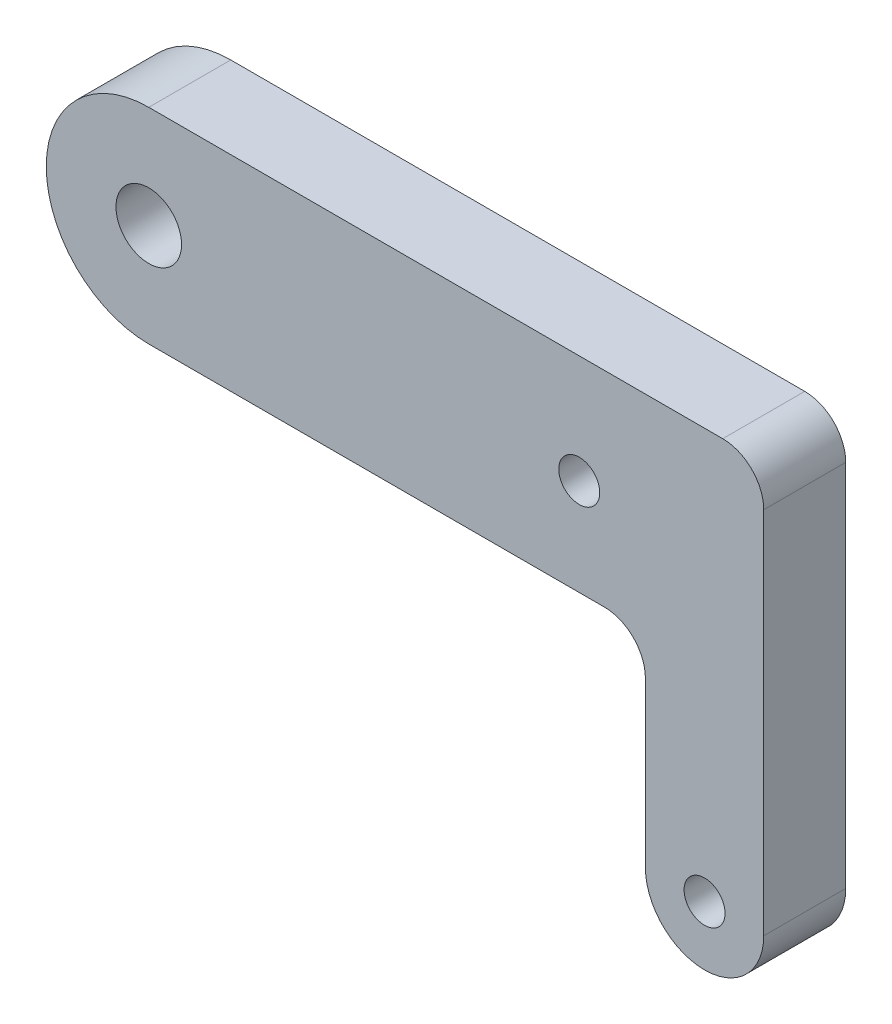
from build123d import *

# Parameters (mm, degrees)
SKETCH1_R           = 8
SKETCH1_R_2         = 5
BOSS_EXTRUDE1_DEPTH = 20
SKETCH2_R           = 5
CUT_EXTRUDE1_DEPTH  = 35


with BuildPart() as part:
    # Sketch1 → Boss-Extrude1 (new body)
    with BuildSketch(Plane.XY):
        with BuildLine():
            Line((-10, 0), (-150, 0))
            ThreePointArc((-150, 0), (-175, -25), (-150, -50))
            Line((-150, -50), (-38.867513459, -50))
            ThreePointArc((-38.867513459, -50), (-31.796445648, -52.928932188), (-28.867513459, -60))
            Line((-28.867513459, -60), (-28.867513459, -100))
            ThreePointArc((-28.867513459, -100), (-14.43375673, -114.43375673), (0, -100))
            Line((0, -100), (0, -10))
            ThreePointArc((0, -10), (-2.928932188, -2.928932188), (-10, 0))
        make_face()
        with Locations((-150, -25)):
            Circle(SKETCH1_R, mode=Mode.SUBTRACT)
        with Locations((-14.43375673, -100)):
            Circle(SKETCH1_R_2, mode=Mode.SUBTRACT)
    extrude(amount=BOSS_EXTRUDE1_DEPTH)

    # Sketch2 → Cut-Extrude1 (cut)
    with BuildSketch(Plane.XY.offset(20)):
        with Locations((-45, -26.406771576)):
            Circle(SKETCH2_R)
    extrude(amount=-CUT_EXTRUDE1_DEPTH, mode=Mode.SUBTRACT)


solid = part.part
